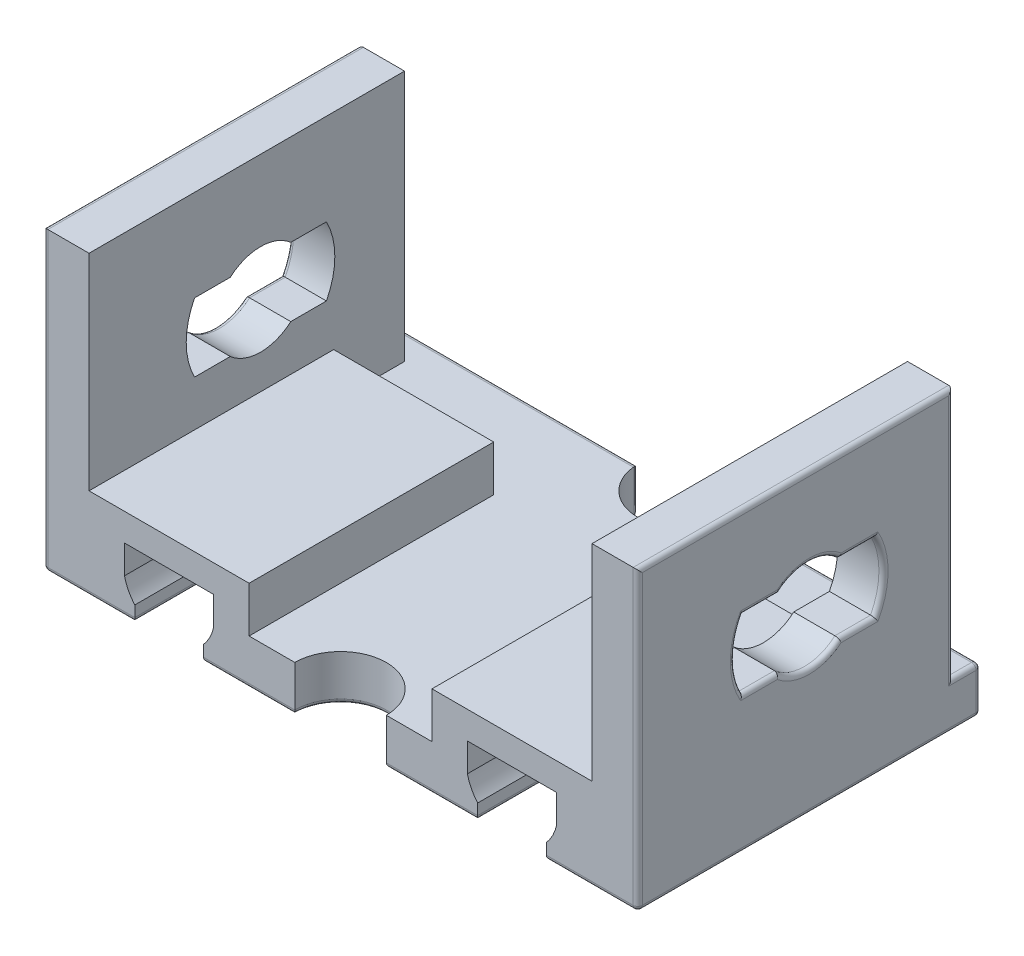
from build123d import *

# Parameters (mm, degrees)
SKETCH_1_W          = 26
SKETCH_1_H          = 15
EXTRUDE_1_DEPTH     = 2
SKETCH_2_W          = 2
SKETCH_2_H          = 13.8
EXTRUDE_2_DEPTH     = 11
SKETCH_3_W          = 7
SKETCH_3_H          = 10.7
EXTRUDE_3_DEPTH     = 2
CUT_EXTRUDE_1_REACH = 32.021
CUT_EXTRUDE_2_DEPTH = 10
CUT_EXTRUDE_3_REACH = 20.608
SKETCH_6_R          = 2
FILLET_1_R          = 0.2


with BuildPart() as part:
    # 草图1 → 凸台-拉伸1 (new body)
    with BuildSketch(Plane(origin=(0, 0, 0), x_dir=(1, 0, 0), z_dir=(0, 1, 0))):
        Rectangle(SKETCH_1_W, SKETCH_1_H)
    extrude(amount=EXTRUDE_1_DEPTH)

    # 草图2 → 凸台-拉伸2 (add)
    with BuildSketch(Plane(origin=(0, 2, 0), x_dir=(1, 0, 0), z_dir=(0, 1, 0))):
        with Locations((-12, -0.6)):
            Rectangle(SKETCH_2_W, SKETCH_2_H)
    extrude_2 = extrude(amount=EXTRUDE_2_DEPTH)

    # 草图3 → 凸台-拉伸3 (add)
    with BuildSketch(Plane(origin=(0, 2, 0), x_dir=(1, 0, 0), z_dir=(0, 1, 0))):
        with Locations((-7.5, -2.15)):
            Rectangle(SKETCH_3_W, SKETCH_3_H)
    extrude_3 = extrude(amount=EXTRUDE_3_DEPTH)

    # 草图4 → 切除-拉伸1 (cut, up to next)
    with BuildSketch(Plane.ZY.offset(13), mode=Mode.PRIVATE) as cut_extrude_1_sk1:
        with BuildLine():
            Line((-2.883140649, 6), (-1.322875656, 6))
            ThreePointArc((-1.322875656, 6), (0, 5.5), (1.322875656, 6))
            Line((1.322875656, 6), (2.883140649, 6))
            ThreePointArc((2.883140649, 6), (3.25, 7.5), (2.883140649, 9))
            Line((2.883140649, 9), (1.322875656, 9))
            ThreePointArc((1.322875656, 9), (0, 9.5), (-1.322875656, 9))
            Line((-1.322875656, 9), (-2.883140649, 9))
            ThreePointArc((-2.883140649, 9), (-3.25, 7.5), (-2.883140649, 6))
        make_face()
    cut_extrude_1_tool1 = extrude(cut_extrude_1_sk1.sketch, amount=-CUT_EXTRUDE_1_REACH, mode=Mode.PRIVATE) & part.part
    cut_extrude_1 = cut_extrude_1_tool1.solids().sort_by_distance((-13, 7.5, 0))[0]
    add(cut_extrude_1, mode=Mode.SUBTRACT)

    # 草图5 → 切除-拉伸2 (cut)
    with BuildSketch(Plane.XY.offset(7.5)):
        with BuildLine():
            Line((-6, 0), (-9, 0))
            Line((-9, 0), (-9, 0.677124344))
            ThreePointArc((-9, 0.677124344), (-9.280042303, 1.088161527), (-9.45, 1.555590279))
            Line((-9.45, 1.555590279), (-9.45, 2.8))
            Line((-9.45, 2.8), (-5.55, 2.8))
            Line((-5.55, 2.8), (-5.55, 1.555590279))
            ThreePointArc((-5.55, 1.555590279), (-5.719957697, 1.088161527), (-6, 0.677124344))
            Line((-6, 0.677124344), (-6, 0))
        make_face()
    cut_extrude_2 = extrude(amount=-CUT_EXTRUDE_2_DEPTH, mode=Mode.SUBTRACT)

    # 镜向1: 凸台-拉伸2, 凸台-拉伸3, 切除-拉伸1, 切除-拉伸2 across plane
    add(extrude_2.mirror(Plane(origin=(0, 0, 0), x_dir=(0, 0, 1), z_dir=(1, 0, 0))))
    add(extrude_3.mirror(Plane(origin=(0, 0, 0), x_dir=(0, 0, 1), z_dir=(1, 0, 0))))
    add(cut_extrude_1.mirror(Plane(origin=(0, 0, 0), x_dir=(0, 0, 1), z_dir=(1, 0, 0))), mode=Mode.SUBTRACT)
    add(cut_extrude_2.mirror(Plane(origin=(0, 0, 0), x_dir=(0, 0, 1), z_dir=(1, 0, 0))), mode=Mode.SUBTRACT)

    # 草图6 → 切除-拉伸3 (cut, up to next)
    with BuildSketch(Plane(origin=(0, 2, 0), x_dir=(1, 0, 0), z_dir=(0, 1, 0)), mode=Mode.PRIVATE) as cut_extrude_3_sk1:
        with Locations((0, -7.5)):
            Circle(SKETCH_6_R)
    cut_extrude_3_tool1 = extrude(cut_extrude_3_sk1.sketch, amount=-CUT_EXTRUDE_3_REACH, mode=Mode.PRIVATE) & part.part
    # 草图6 → 切除-拉伸3 (cut, up to next)
    with BuildSketch(Plane(origin=(0, 2, 0), x_dir=(1, 0, 0), z_dir=(0, 1, 0)), mode=Mode.PRIVATE) as cut_extrude_3_sk2:
        with Locations((0, 7.5)):
            Circle(SKETCH_6_R)
    cut_extrude_3_tool2 = extrude(cut_extrude_3_sk2.sketch, amount=-CUT_EXTRUDE_3_REACH, mode=Mode.PRIVATE) & part.part
    add(cut_extrude_3_tool1.solids().sort_by_distance((0, 2, 7.5))[0], mode=Mode.SUBTRACT)
    add(cut_extrude_3_tool2.solids().sort_by_distance((0, 2, -7.5))[0], mode=Mode.SUBTRACT)

    # 圆角1
    fillet_1_edges = [part.edges().sort_by_distance(p)[0] for p in [
        (13, 5.5, 0),
        (13, 6, 2.103008152),
        (13, 7.5, 3.25),
        (13, 9, 2.103008152),
        (13, 9.5, 0),
        (13, 9, -2.103008152),
        (13, 7.5, -3.25),
        (13, 6, -2.103008152),
        (11, 0, 7.5),
        (6, 0, 2.5),
        (9, 0, 2.5),
        (7.5, 0, -2.5),
        (-13, 7.5, -6.3),
        (4, 0, 7.5),
        (0, 0, 5.5),
        (-13, 13, 0.6),
        (-7.5, 0, -7.5),
        (-7.5, 2, -7.5),
        (2, 1, -7.5),
        (-2, 1, -7.5),
        (0, 0, -5.5),
        (7.5, 2, -7.5),
        (13, 0, 0),
        (-11, 0, 7.5),
        (-13, 5.5, 0),
        (-13, 6, 2.103008152),
        (-13, 7.5, 3.25),
        (-13, 9, 2.103008152),
        (-13, 9.5, 0),
        (-13, 9, -2.103008152),
        (-13, 7.5, -3.25),
        (-13, 6, -2.103008152),
        (-13, 0, 0),
        (7.5, 0, -7.5),
        (-4, 0, 7.5),
        (-13, 2, -6.9),
        (13, 1, -7.5),
        (-7.5, 0, -2.5),
        (-6, 0, 2.5),
        (-9, 0, 2.5),
        (13, 6.5, 7.5),
        (-13, 6.5, 7.5),
        (-13, 1, -7.5),
        (13, 2, -6.9),
        (13, 13, 0.6),
        (13, 7.5, -6.3),
    ]]
    fillet(fillet_1_edges, radius=FILLET_1_R)


solid = part.part
